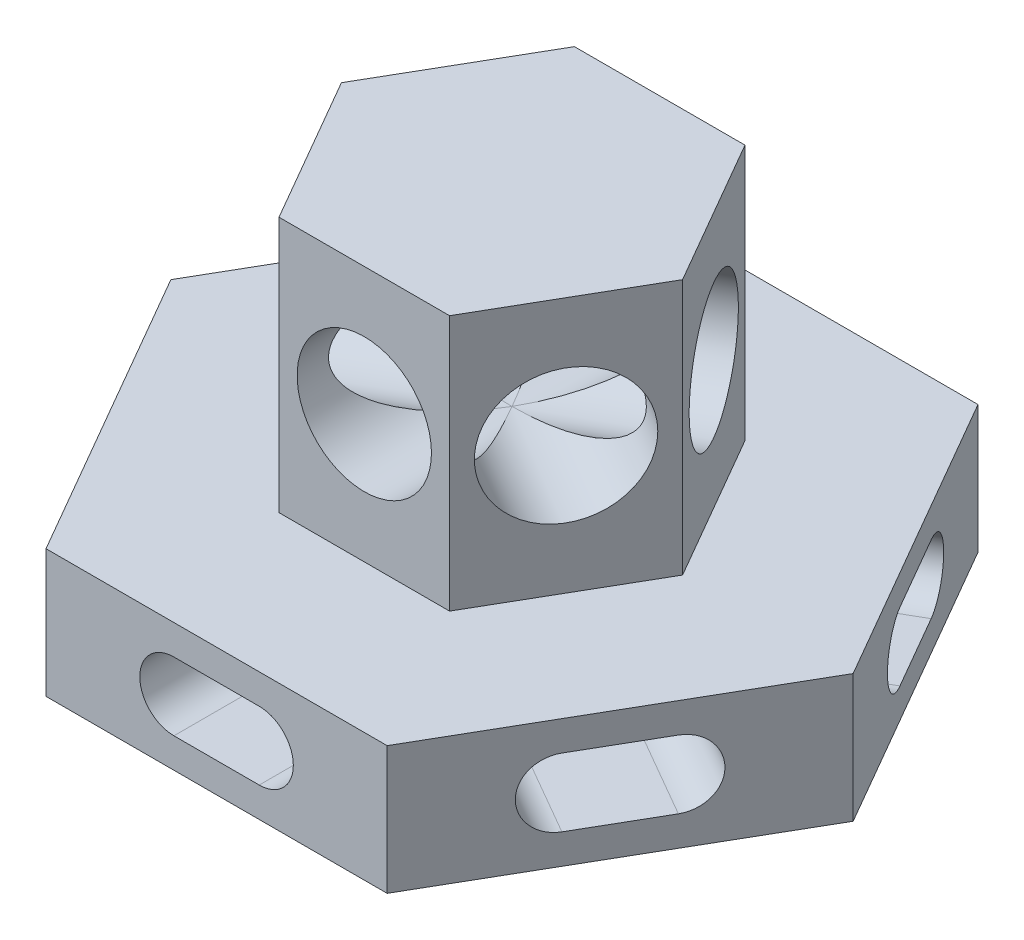
from build123d import *

# Parameters (mm, degrees)
BOSS_EXTRUDE1_DEPTH = 30
BOSS_EXTRUDE2_DEPTH = 60
HOLE1_D             = 31.5
CIRPATTERN2_COUNT   = 6
CUT_EXTRUDE1_DEPTH  = 184.575597507
CIRPATTERN3_COUNT   = 6


with BuildPart() as part:
    # Sketch1 → Boss-Extrude1 (new body)
    with BuildSketch(Plane(origin=(0, 0, 0), x_dir=(1, 0, 0), z_dir=(0, 1, 0))):
        Polygon((40, -69.282032303), (80, 0), (40, 69.282032303), (-40, 69.282032303), (-80, 0), (-40, -69.282032303), align=None)
    extrude(amount=BOSS_EXTRUDE1_DEPTH)

    # Sketch2 → Boss-Extrude2 (add)
    with BuildSketch(Plane(origin=(0, 30, 0), x_dir=(1, 0, 0), z_dir=(0, 1, 0))):
        Polygon((20, -34.641016151), (40, 0), (20, 34.641016151), (-20, 34.641016151), (-40, 0), (-20, -34.641016151), align=None)
    extrude(amount=BOSS_EXTRUDE2_DEPTH)

    # Hole1 (through all)
    with Locations(Plane.XY.offset(34.641016151)):
        with Locations((0, 60)):
            hole1 = Hole(HOLE1_D / 2)

    # CirPattern2: Hole1 ×6 about axis
    cirpattern2_axis = Axis((0, 90, 0), (0, 1, 0))
    for i in range(1, CIRPATTERN2_COUNT):
        add(hole1.rotate(cirpattern2_axis, i * 360 / CIRPATTERN2_COUNT), mode=Mode.SUBTRACT)

    # Sketch5 → Cut-Extrude1 (cut, symmetric)
    with BuildSketch(Plane.XY.offset(69.282032303)):
        with BuildLine():
            Line((-10, 23), (10, 23))
            ThreePointArc((10, 23), (18, 15), (10, 7))
            Line((10, 7), (-10, 7))
            ThreePointArc((-10, 7), (-18, 15), (-10, 23))
        make_face()
    cut_extrude1 = extrude(amount=CUT_EXTRUDE1_DEPTH, both=True, mode=Mode.SUBTRACT)

    # CirPattern3: Cut-Extrude1 ×6 about axis
    cirpattern3_axis = Axis((0, 90, 0), (0, 1, 0))
    for i in range(1, CIRPATTERN3_COUNT):
        add(cut_extrude1.rotate(cirpattern3_axis, i * 360 / CIRPATTERN3_COUNT), mode=Mode.SUBTRACT)


solid = part.part
